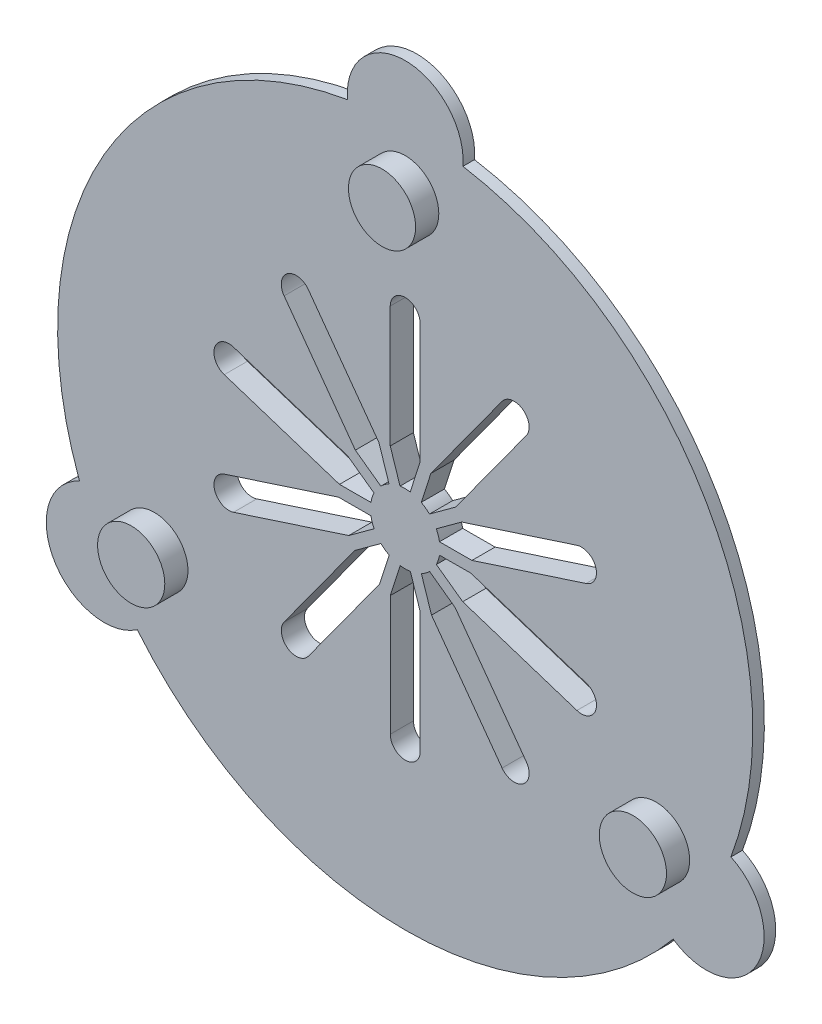
from build123d import *

# Parameters (mm, degrees)
SKETCH2_R           = 18.85
BOSS_EXTRUDE1_DEPTH = 2
BOSS_EXTRUDE2_START = -1
SKETCH3_R           = 30
SKETCH3_R_2         = 18.85
BOSS_EXTRUDE2_DEPTH = 1
SKETCH4_R           = 2.9
BOSS_EXTRUDE3_DEPTH = 2
SKETCH6_R           = 5
BOSS_EXTRUDE4_DEPTH = 1
BOSS_EXTRUDE5_DEPTH = 2
SKETCH13_R          = 3
BOSS_EXTRUDE6_DEPTH = 2


with BuildPart() as part:
    # Sketch2 → Boss-Extrude1 (new body)
    with BuildSketch(Plane.XY.offset(10)):
        Circle(SKETCH2_R)
        with BuildLine():
            ThreePointArc((-1.294063412, 15.999741695), (-0.003455665, 17.290865413), (1.287668054, 16.000257666))
            Line((1.287668054, 16.000257666), (1.290071734, 3.973134201))
            Line((1.290071734, 3.973134201), (8.357492916, 13.704694326))
            ThreePointArc((8.357492916, 13.704694326), (10.160519997, 13.990635156), (10.446460828, 12.187608075))
            Line((10.446460828, 12.187608075), (3.379039645, 2.45604795))
            Line((3.379039645, 2.45604795), (14.816771011, 6.17491953))
            ThreePointArc((14.816771011, 6.17491953), (16.443522365, 5.346457793), (15.615060628, 3.71970644))
            Line((15.615060628, 3.71970644), (4.177329262, 0.00083486))
            Line((4.177329262, 0.00083486), (15.616546184, -3.713464648))
            ThreePointArc((15.616546184, -3.713464648), (16.445658083, -5.339884727), (14.819238004, -6.168996626))
            Line((14.819238004, -6.168996626), (3.380021082, -2.454697118))
            Line((3.380021082, -2.454697118), (10.451331501, -12.183431547))
            ThreePointArc((10.451331501, -12.183431547), (10.166111381, -13.986572778), (8.362970151, -13.701352658))
            Line((8.362970151, -13.701352658), (1.291659732, -3.972618229))
            Line((1.291659732, -3.972618229), (1.294063412, -15.999741695))
            ThreePointArc((1.294063412, -15.999741695), (0.003455665, -17.290865413), (-1.287668054, -16.000257666))
            Line((-1.287668054, -16.000257666), (-1.290071734, -3.973134201))
            Line((-1.290071734, -3.973134201), (-8.357492916, -13.704694326))
            ThreePointArc((-8.357492916, -13.704694326), (-10.160519997, -13.990635156), (-10.446460828, -12.187608075))
            Line((-10.446460828, -12.187608075), (-3.379039645, -2.45604795))
            Line((-3.379039645, -2.45604795), (-14.816771011, -6.17491953))
            ThreePointArc((-14.816771011, -6.17491953), (-16.443522365, -5.346457793), (-15.615060628, -3.71970644))
            Line((-15.615060628, -3.71970644), (-4.177329262, -0.00083486))
            Line((-4.177329262, -0.00083486), (-15.616546184, 3.713464648))
            ThreePointArc((-15.616546184, 3.713464648), (-16.445658083, 5.339884727), (-14.819238004, 6.168996626))
            Line((-14.819238004, 6.168996626), (-3.380021082, 2.454697118))
            Line((-3.380021082, 2.454697118), (-10.451331501, 12.183431547))
            ThreePointArc((-10.451331501, 12.183431547), (-10.166111381, 13.986572778), (-8.362970151, 13.701352658))
            Line((-8.362970151, 13.701352658), (-1.291659732, 3.972618229))
            Line((-1.291659732, 3.972618229), (-1.294063412, 15.999741695))
        make_face(mode=Mode.SUBTRACT)
    extrude(amount=BOSS_EXTRUDE1_DEPTH)

    # Sketch3 → Boss-Extrude2 (add)
    with BuildSketch(Plane.XY.offset(12).offset(BOSS_EXTRUDE2_START)):
        Circle(SKETCH3_R)
        Circle(SKETCH3_R_2, mode=Mode.SUBTRACT)
    extrude(amount=BOSS_EXTRUDE2_DEPTH)

    # Sketch4 → Boss-Extrude3 (add)
    with BuildSketch(Plane.XY.offset(12)):
        with Locations((0, 25)):
            Circle(SKETCH4_R)
        with Locations((21.650635095, -12.5)):
            Circle(SKETCH4_R)
        with Locations((-21.650635095, -12.5)):
            Circle(SKETCH4_R)
    extrude(amount=BOSS_EXTRUDE3_DEPTH)

    # Sketch6 → Boss-Extrude4 (add)
    with BuildSketch(Plane(origin=(0, 0, 11), x_dir=(-1, 0, 0), z_dir=(0, 0, -1))):
        with Locations((0, 30)):
            Circle(SKETCH6_R)
        with Locations((25.980762114, -15)):
            Circle(SKETCH6_R)
        with Locations((-25.980762114, -15)):
            Circle(SKETCH6_R)
    extrude(amount=-BOSS_EXTRUDE4_DEPTH)

    # Sketch12 → Boss-Extrude5 (add)
    with BuildSketch(Plane(origin=(0, 0, 10), x_dir=(-1, 0, 0), z_dir=(0, 0, -1))):
        with BuildLine():
            Line((-2.213684697, 5.244912811), (-1.382375366, 2.662524807))
            ThreePointArc((-1.382375366, 2.662524807), (-0.919286358, 2.855680758), (-0.43048178, 2.968953593))
            Line((-0.43048178, 2.968953593), (-1.28973897, 5.638159118))
            Line((-1.28973897, 5.638159118), (-1.290071734, 3.973134201))
            Line((-1.290071734, 3.973134201), (-2.213684697, 5.244912811))
        make_face()
        with BuildLine():
            Line((1.291973859, 5.544394816), (0.446627652, 2.96656767))
            ThreePointArc((0.446627652, 2.96656767), (0.934808749, 2.850637228), (1.396840061, 2.654964754))
            Line((1.396840061, 2.654964754), (2.270606035, 5.31945609))
            Line((2.270606035, 5.31945609), (1.291659732, 3.972618229))
            Line((1.291659732, 3.972618229), (1.291973859, 5.544394816))
        make_face()
        with BuildLine():
            ThreePointArc((2.105034087, 2.137482513), (2.431838686, 1.756747166), (2.690616475, 1.326869617))
            Line((2.690616475, 1.326869617), (4.963656709, 2.968901637))
            Line((4.963656709, 2.968901637), (3.380021082, 2.454697118))
            Line((3.380021082, 2.454697118), (4.304142315, 3.726106449))
            Line((4.304142315, 3.726106449), (2.105034087, 2.137482513))
        make_face()
        with BuildLine():
            ThreePointArc((3, 0), (2.989147583, -0.254944562), (2.956668847, -0.508044614))
            Line((2.956668847, -0.508044614), (5.76075923, -0.515672332))
            Line((5.76075923, -0.515672332), (4.177329262, -0.00083486))
            Line((4.177329262, -0.00083486), (5.672274698, 0.484572064))
            Line((5.672274698, 0.484572064), (2.959389048, 0.491951686))
            ThreePointArc((2.959389048, 0.491951686), (2.989830024, 0.246812536), (3, 0))
        make_face()
        with BuildLine():
            ThreePointArc((2.683357979, -1.341487964), (2.422245321, -1.7699513), (2.093374212, -2.148903071))
            Line((2.093374212, -2.148903071), (4.357447525, -3.803276998))
            Line((4.357447525, -3.803276998), (3.379039645, -2.45604795))
            Line((3.379039645, -2.45604795), (4.87379094, -2.94205238))
            Line((4.87379094, -2.94205238), (2.683357979, -1.341487964))
        make_face()
        with BuildLine():
            ThreePointArc((1.382375366, -2.662524807), (0.919286358, -2.855680758), (0.43048178, -2.968953593))
            Line((0.43048178, -2.968953593), (1.28973897, -5.638159118))
            Line((1.28973897, -5.638159118), (1.290071734, -3.973134201))
            Line((1.290071734, -3.973134201), (2.213684697, -5.244912811))
            Line((2.213684697, -5.244912811), (1.382375366, -2.662524807))
        make_face()
        with BuildLine():
            Line((-1.396840061, -2.654964754), (-2.270606035, -5.31945609))
            Line((-2.270606035, -5.31945609), (-1.291659732, -3.972618229))
            Line((-1.291659732, -3.972618229), (-1.291973859, -5.544394816))
            Line((-1.291973859, -5.544394816), (-0.446627652, -2.96656767))
            ThreePointArc((-0.446627652, -2.96656767), (-0.934808749, -2.850637228), (-1.396840061, -2.654964754))
        make_face()
        with BuildLine():
            Line((-4.304142315, -3.726106449), (-2.105034087, -2.137482513))
            ThreePointArc((-2.105034087, -2.137482513), (-2.431838686, -1.756747166), (-2.690616475, -1.326869617))
            Line((-2.690616475, -1.326869617), (-4.963656709, -2.968901637))
            Line((-4.963656709, -2.968901637), (-3.380021082, -2.454697118))
            Line((-3.380021082, -2.454697118), (-4.304142315, -3.726106449))
        make_face()
        with BuildLine():
            Line((-5.672274698, -0.484572064), (-2.959389048, -0.491951686))
            ThreePointArc((-2.959389048, -0.491951686), (-2.999988901, 0.008160604), (-2.956668847, 0.508044614))
            Line((-2.956668847, 0.508044614), (-5.76075923, 0.515672332))
            Line((-5.76075923, 0.515672332), (-4.177329262, 0.00083486))
            Line((-4.177329262, 0.00083486), (-5.672274698, -0.484572064))
        make_face()
        with BuildLine():
            Line((-4.87379094, 2.94205238), (-2.683357979, 1.341487964))
            ThreePointArc((-2.683357979, 1.341487964), (-2.422245321, 1.7699513), (-2.093374212, 2.148903071))
            Line((-2.093374212, 2.148903071), (-4.357447525, 3.803276998))
            Line((-4.357447525, 3.803276998), (-3.379039645, 2.45604795))
            Line((-3.379039645, 2.45604795), (-4.87379094, 2.94205238))
        make_face()
    extrude(amount=-BOSS_EXTRUDE5_DEPTH)

    # Sketch13 → Boss-Extrude6 (add)
    with BuildSketch(Plane(origin=(0, 0, 10), x_dir=(-1, 0, 0), z_dir=(0, 0, -1))):
        Circle(SKETCH13_R)
    extrude(amount=-BOSS_EXTRUDE6_DEPTH)


solid = part.part
